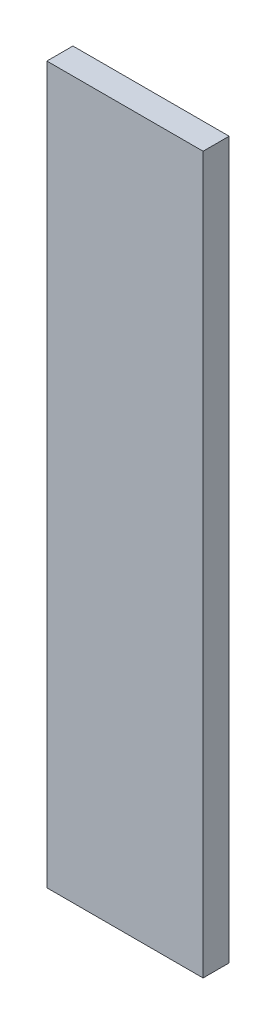
from build123d import *

# Parameters (mm, degrees)
SZKIC1_W                    = 12
SZKIC1_H                    = 55
DODANIE_WYCI_GNI_CIE1_DEPTH = 2


with BuildPart() as part:
    # Szkic1 → Dodanie-wyciągnięcie1 (new body)
    with BuildSketch(Plane.XY):
        Rectangle(SZKIC1_W, SZKIC1_H)
    extrude(amount=DODANIE_WYCI_GNI_CIE1_DEPTH)


solid = part.part
